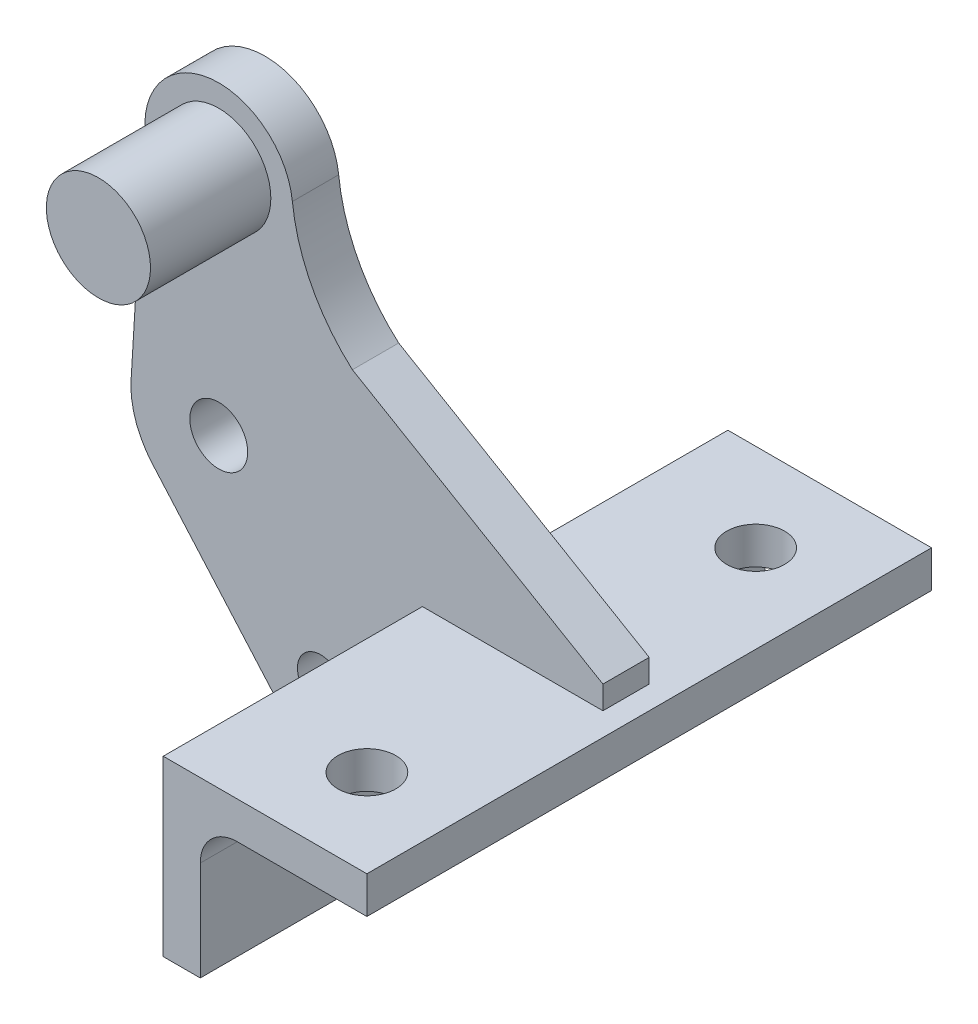
from build123d import *

# Parameters (mm, degrees)
SKETCH8_R                 = 22.5
BOSS_EXTRUDE14_DEPTH      = 62
BOSS_EXTRUDE15_DEPTH      = 10
BOSS_EXTRUDE15_DEPTH_BACK = 10
SKETCH2_R                 = 10
SKETCH2_R_2               = 12.5
BOSS_EXTRUDE16_DEPTH      = 122
BOSS_EXTRUDE16_DEPTH_BACK = 122
SKETCH9_R                 = 12.5
CUT_EXTRUDE1_DEPTH        = 16


with BuildPart() as part:
    # Sketch8 → Boss-Extrude14 (new body)
    with BuildSketch(Plane.XY):
        with Locations((-88, 195)):
            Circle(SKETCH8_R)
    extrude(amount=BOSS_EXTRUDE14_DEPTH)

    # Sketch2 → Boss-Extrude15 (add, two sides: drawn at the far end of the back side and taken through both)
    with BuildSketch(Plane.XY.offset(-BOSS_EXTRUDE15_DEPTH_BACK)):
        with BuildLine():
            Line((-44, 0), (0, 0))
            Line((0, 0), (0, 75))
            Line((0, 75), (78, 75))
            Line((78, 75), (78, 85))
            Line((78, 85), (-30.246353585, 148.497970332))
            ThreePointArc((-30.246353585, 148.497970332), (-47.888697043, 171.070854158), (-56.190983138, 198.490909091))
            ThreePointArc((-56.190983138, 198.490909091), (-87.414850516, 226.994649554), (-119.660096955, 199.651694401))
            Line((-119.660096955, 199.651694401), (-126, 95))
            ThreePointArc((-126, 95), (-123.479967643, 81.392211935), (-116.254110736, 69.589269461))
            Line((-116.254110736, 69.589269461), (-62.588230747, 8.282414119))
            ThreePointArc((-62.588230747, 8.282414119), (-54.17497796, 2.164286227), (-44, 0))
        make_face()
        with Locations((-44, 25)):
            Circle(SKETCH2_R, mode=Mode.SUBTRACT)
        with Locations((-88, 95)):
            Circle(SKETCH2_R_2, mode=Mode.SUBTRACT)
    extrude(amount=BOSS_EXTRUDE15_DEPTH + BOSS_EXTRUDE15_DEPTH_BACK)

    # Sketch3 → Boss-Extrude16 (add, two sides: drawn at the far end of the back side and taken through both)
    with BuildSketch(Plane.XY.offset(-BOSS_EXTRUDE16_DEPTH_BACK)):
        with BuildLine():
            Line((0, 0), (0, 75))
            Line((0, 75), (78, 75))
            Line((78, 75), (88, 75))
            Line((88, 75), (88, 59))
            Line((88, 59), (32, 59))
            ThreePointArc((32, 59), (20.686291501, 54.313708499), (16, 43))
            Line((16, 43), (16, 0))
            Line((16, 0), (0, 0))
        make_face()
    extrude(amount=BOSS_EXTRUDE16_DEPTH + BOSS_EXTRUDE16_DEPTH_BACK)

    # Sketch9 → Cut-Extrude1 (cut)
    with BuildSketch(Plane(origin=(0, 75, 0), x_dir=(1, 0, 0), z_dir=(0, 1, 0))):
        with Locations((50, -84)):
            Circle(SKETCH9_R)
        with Locations((50, 84)):
            Circle(SKETCH9_R)
    extrude(amount=-CUT_EXTRUDE1_DEPTH, mode=Mode.SUBTRACT)


solid = part.part
